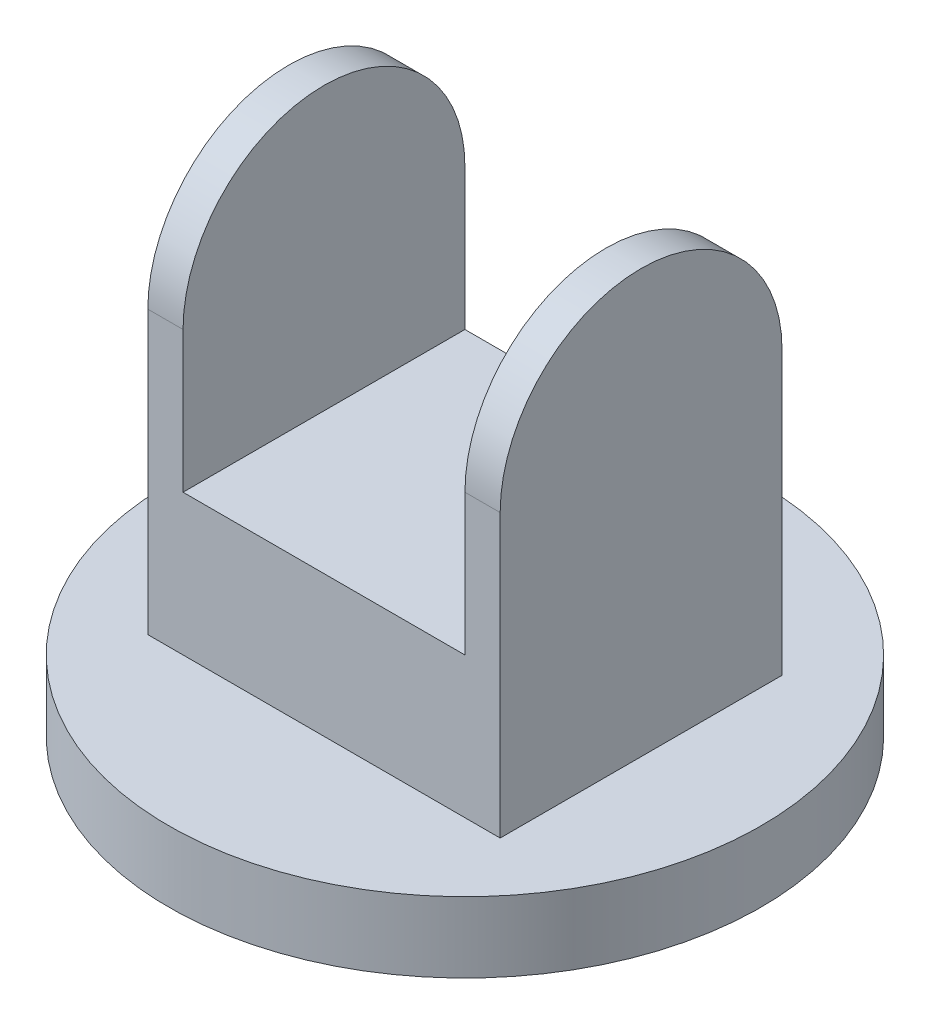
from build123d import *

# Parameters (mm, degrees)
BOSS_EXTRUDE1_DEPTH = 100
SKETCH2_R           = 84.031242374
BOSS_EXTRUDE2_DEPTH = 20
SKETCH3_W           = 80
SKETCH3_H           = 80
CUT_EXTRUDE1_DEPTH  = 200.369313128


with BuildPart() as part:
    # Sketch1 → Boss-Extrude1 (new body)
    with BuildSketch(Plane(origin=(0, 0, 0), x_dir=(0, 0, -1), z_dir=(1, 0, 0))):
        with BuildLine():
            Line((-40, 40), (-40, -40))
            Line((-40, -40), (40, -40))
            Line((40, -40), (40, 40))
            ThreePointArc((40, 40), (0, 80), (-40, 40))
        make_face()
    extrude(amount=BOSS_EXTRUDE1_DEPTH)

    # Sketch2 → Boss-Extrude2 (add)
    with BuildSketch(Plane.XZ.offset(40)):
        with Locations(Location((50, 0, 0), (0, 0, 270))):
            Circle(SKETCH2_R)
    extrude(amount=BOSS_EXTRUDE2_DEPTH)

    # Sketch3 → Cut-Extrude1 (cut, through all)
    with BuildSketch(Plane.XY.offset(40)):
        with Locations((50, 40)):
            Rectangle(SKETCH3_W, SKETCH3_H)
    extrude(amount=-CUT_EXTRUDE1_DEPTH, mode=Mode.SUBTRACT)


solid = part.part
